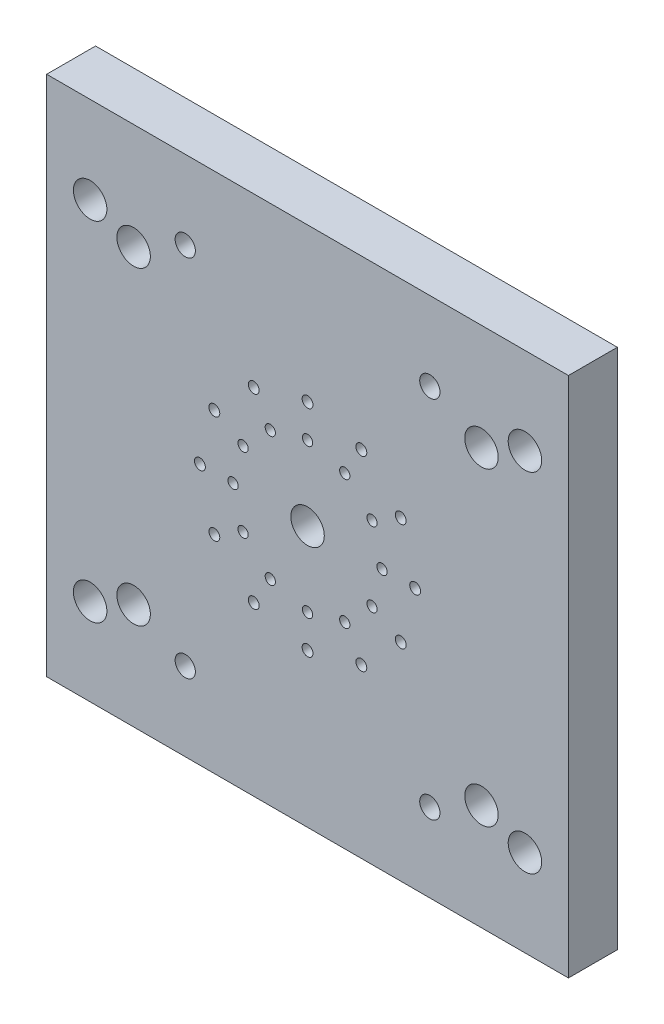
from build123d import *

# Parameters (mm, degrees)
SKETCH1_W                               = 304.8
SKETCH1_H                               = 304.8
BOSS_EXTRUDE1_DEPTH                     = 28.575
SKETCH2_R                               = 6.5151
HAAS_T_SLOT_HOLES_DEPTH                 = 218.41216761
SKETCH3_R                               = 9.779
HAAS_COUNTER_BORES_DEPTH                = 19.05
SKETCH4_R                               = 6.5151
TORMACH_T_SLOT_HOLES_DEPTH              = 218.41216761
SKETCH5_R                               = 9.779
TORMACH_COUNTER_BORES_DEPTH             = 19.05
SKETCH6_R                               = 2.99974
SPROCKET_LOCATING_HOLES_DEPTH           = 19.05
SKETCH7_R                               = 2.99974
SPROCKET_MOUNTING_CLEARANCE_HOLES_DEPTH = 19.05
SKETCH8_R                               = 5.9182
F_1_2_13_TAPPED_HOLES_DEPTH             = 19.05
SKETCH9_R                               = 3.175
F_1_4_20_SPROCKET_FIXTURE_BOLTS_DEPTH   = 19.05


with BuildPart() as part:
    # Sketch1 → Boss-Extrude1 (new body)
    with BuildSketch(Plane.XY):
        Rectangle(SKETCH1_W, SKETCH1_H)
    extrude(amount=BOSS_EXTRUDE1_DEPTH)

    # Sketch2 → HAAS T-Slot Holes (cut, through all)
    with BuildSketch(Plane.XY.offset(28.575)):
        with Locations((-127, 101.6)):
            Circle(SKETCH2_R)
        with Locations((127, 101.6)):
            Circle(SKETCH2_R)
        with Locations((127, -101.6)):
            Circle(SKETCH2_R)
        with Locations((-127, -101.6)):
            Circle(SKETCH2_R)
        Circle(SKETCH2_R)
    extrude(amount=-HAAS_T_SLOT_HOLES_DEPTH, mode=Mode.SUBTRACT)

    # Sketch3 → HAAS Counter Bores (cut)
    with BuildSketch(Plane.XY.offset(28.575)):
        with Locations((-127, 101.6)):
            Circle(SKETCH3_R)
        with Locations((127, 101.6)):
            Circle(SKETCH3_R)
        Circle(SKETCH3_R)
        with Locations((127, -101.6)):
            Circle(SKETCH3_R)
        with Locations((-127, -101.6)):
            Circle(SKETCH3_R)
    extrude(amount=-HAAS_COUNTER_BORES_DEPTH, mode=Mode.SUBTRACT)

    # Sketch4 → Tormach T-Slot Holes (cut, through all)
    with BuildSketch(Plane.XY.offset(28.575)):
        with Locations((-101.6, 90.4875)):
            Circle(SKETCH4_R)
        with Locations((101.6, 90.4875)):
            Circle(SKETCH4_R)
        with Locations((-101.6, -90.4875)):
            Circle(SKETCH4_R)
        with Locations((101.6, -90.4875)):
            Circle(SKETCH4_R)
    extrude(amount=-TORMACH_T_SLOT_HOLES_DEPTH, mode=Mode.SUBTRACT)

    # Sketch5 → Tormach Counter bores (cut)
    with BuildSketch(Plane.XY.offset(28.575)):
        with Locations((-101.6, 90.4875)):
            Circle(SKETCH5_R)
        with Locations((101.6, 90.4875)):
            Circle(SKETCH5_R)
        with Locations((101.6, -90.4875)):
            Circle(SKETCH5_R)
        with Locations((-101.6, -90.4875)):
            Circle(SKETCH5_R)
    extrude(amount=-TORMACH_COUNTER_BORES_DEPTH, mode=Mode.SUBTRACT)

    # Sketch6 → Sprocket Locating Holes (cut)
    with BuildSketch(Plane.XY.offset(28.575)):
        with Locations((0, 43.50004)):
            Circle(SKETCH6_R)
        with Locations((0, -43.50004)):
            Circle(SKETCH6_R)
    extrude(amount=-SPROCKET_LOCATING_HOLES_DEPTH, mode=Mode.SUBTRACT)

    # Sketch7 → Sprocket Mounting clearance holes (cut)
    with BuildSketch(Plane.XY.offset(28.575)):
        with Locations((43.50004, 0)):
            Circle(SKETCH7_R)
        with Locations((37.672139706, -21.75002)):
            Circle(SKETCH7_R)
        with Locations((21.75002, -37.672139706)):
            Circle(SKETCH7_R)
        with Locations((-21.75002, -37.672139706)):
            Circle(SKETCH7_R)
        with Locations((-37.672139706, -21.75002)):
            Circle(SKETCH7_R)
        with Locations((-43.50004, 0)):
            Circle(SKETCH7_R)
        with Locations((-37.672139706, 21.75002)):
            Circle(SKETCH7_R)
        with Locations((-21.75002, 37.672139706)):
            Circle(SKETCH7_R)
        with Locations((21.75002, 37.672139706)):
            Circle(SKETCH7_R)
        with Locations((37.672139706, 21.75002)):
            Circle(SKETCH7_R)
    extrude(amount=-SPROCKET_MOUNTING_CLEARANCE_HOLES_DEPTH, mode=Mode.SUBTRACT)

    # Sketch8 → 1/2-13 Tapped Holes (cut)
    with BuildSketch(Plane.XY.offset(28.575)):
        with Locations((-71.4375, 106.4641)):
            Circle(SKETCH8_R)
        with Locations((71.4375, 106.4641)):
            Circle(SKETCH8_R)
        with Locations((71.4375, -106.4641)):
            Circle(SKETCH8_R)
        with Locations((-71.4375, -106.4641)):
            Circle(SKETCH8_R)
    extrude(amount=-F_1_2_13_TAPPED_HOLES_DEPTH, mode=Mode.SUBTRACT)

    # Sketch9 → 1/4-20 Sprocket Fixture Bolts (cut)
    with BuildSketch(Plane.XY.offset(28.575)):
        with Locations((0, 62.865)):
            Circle(SKETCH9_R)
        with Locations((31.4325, 54.442687009)):
            Circle(SKETCH9_R)
        with Locations((54.442687009, 31.4325)):
            Circle(SKETCH9_R)
        with Locations((62.865, 0)):
            Circle(SKETCH9_R)
        with Locations((54.442687009, -31.4325)):
            Circle(SKETCH9_R)
        with Locations((31.4325, -54.442687009)):
            Circle(SKETCH9_R)
        with Locations((0, -62.865)):
            Circle(SKETCH9_R)
        with Locations((-31.4325, -54.442687009)):
            Circle(SKETCH9_R)
        with Locations((-54.442687009, -31.4325)):
            Circle(SKETCH9_R)
        with Locations((-62.865, 0)):
            Circle(SKETCH9_R)
        with Locations((-54.442687009, 31.4325)):
            Circle(SKETCH9_R)
        with Locations((-31.4325, 54.442687009)):
            Circle(SKETCH9_R)
    extrude(amount=-F_1_4_20_SPROCKET_FIXTURE_BOLTS_DEPTH, mode=Mode.SUBTRACT)


solid = part.part
